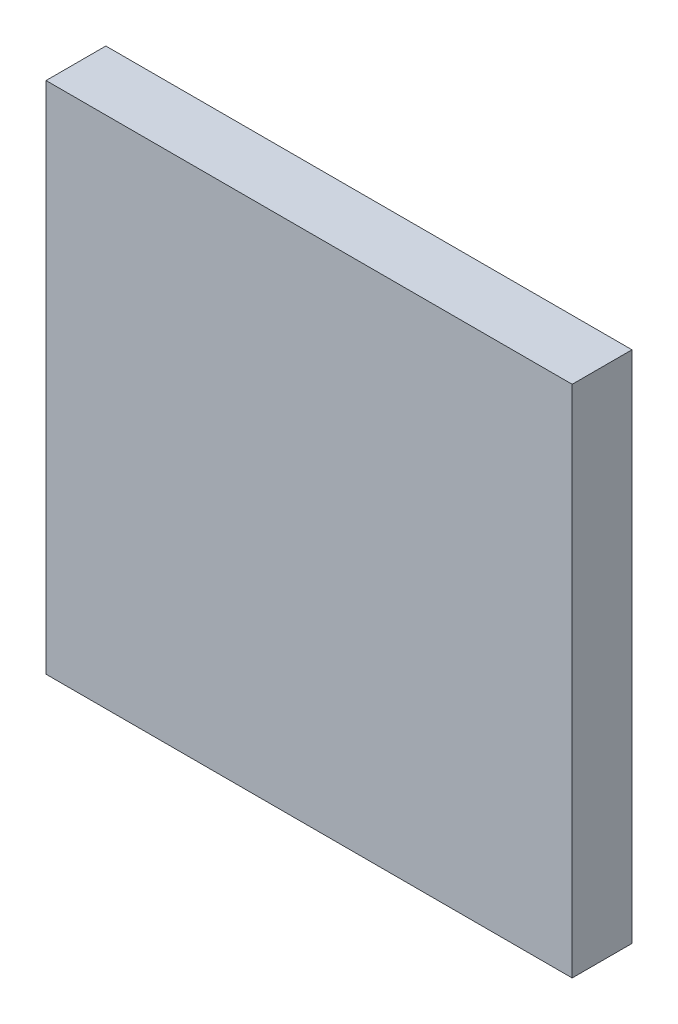
from build123d import *

# Parameters (mm, degrees)
SKETCH1_W           = 88
SKETCH1_H           = 86
BOSS_EXTRUDE1_DEPTH = 10


with BuildPart() as part:
    # Sketch1 → Boss-Extrude1 (new body)
    with BuildSketch(Plane.XY):
        with Locations((44, 43)):
            Rectangle(SKETCH1_W, SKETCH1_H)
    extrude(amount=BOSS_EXTRUDE1_DEPTH)


solid = part.part
